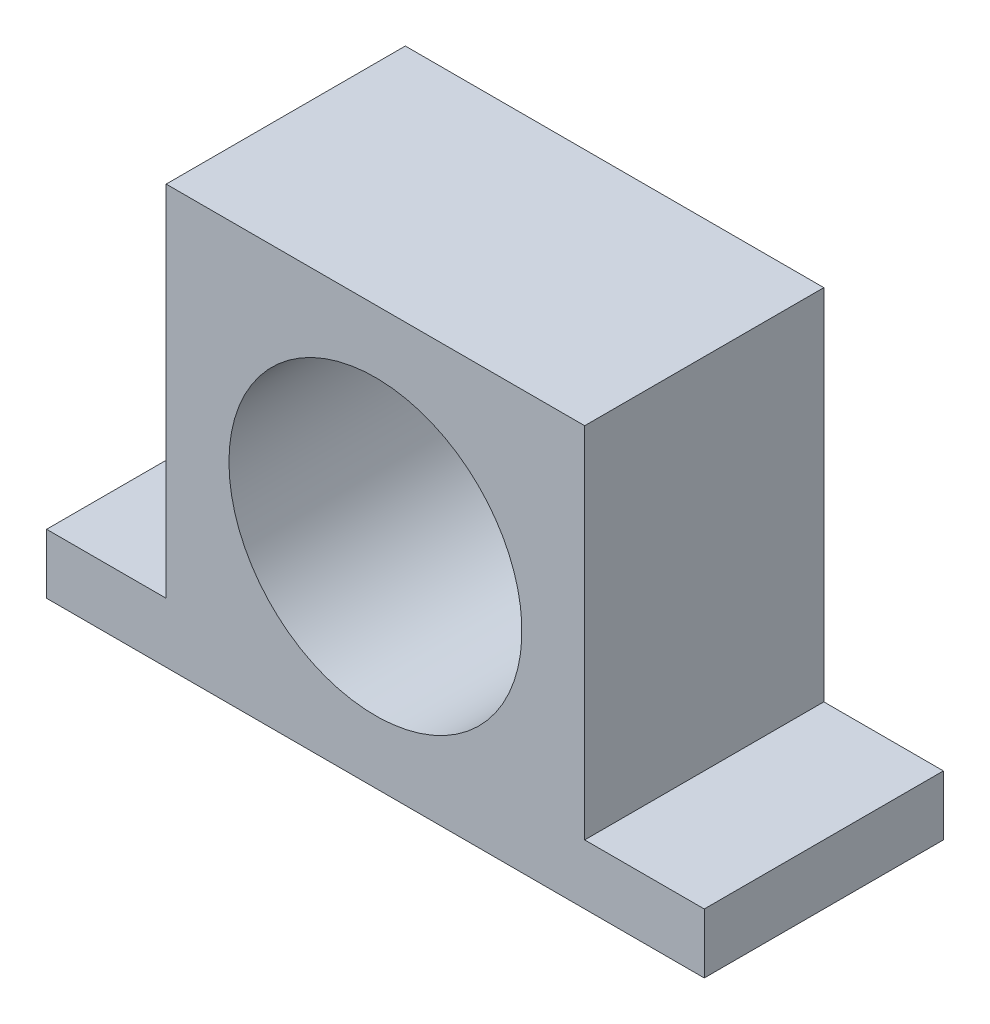
from build123d import *

# Parameters (mm, degrees)
BOSS_EXTRUDE2_DEPTH = 25.4
SKETCH2_R           = 15.5575
CUT_EXTRUDE1_DEPTH  = 49.568160867


with BuildPart() as part:
    # Sketch1 → Boss-Extrude2 (new body)
    with BuildSketch(Plane.XY):
        Polygon((-34.925, -22.225), (34.925, -22.225), (34.925, -15.875), (22.225, -15.875), (22.225, 22.225), (-22.225, 22.225), (-22.225, -15.875), (-34.925, -15.875), align=None)
    extrude(amount=BOSS_EXTRUDE2_DEPTH)

    # Sketch2 → Cut-Extrude1 (cut, through all)
    with BuildSketch(Plane(origin=(0, 0, 0), x_dir=(-1, 0, 0), z_dir=(0, 0, -1))):
        Circle(SKETCH2_R)
    extrude(amount=-CUT_EXTRUDE1_DEPTH, mode=Mode.SUBTRACT)


solid = part.part
